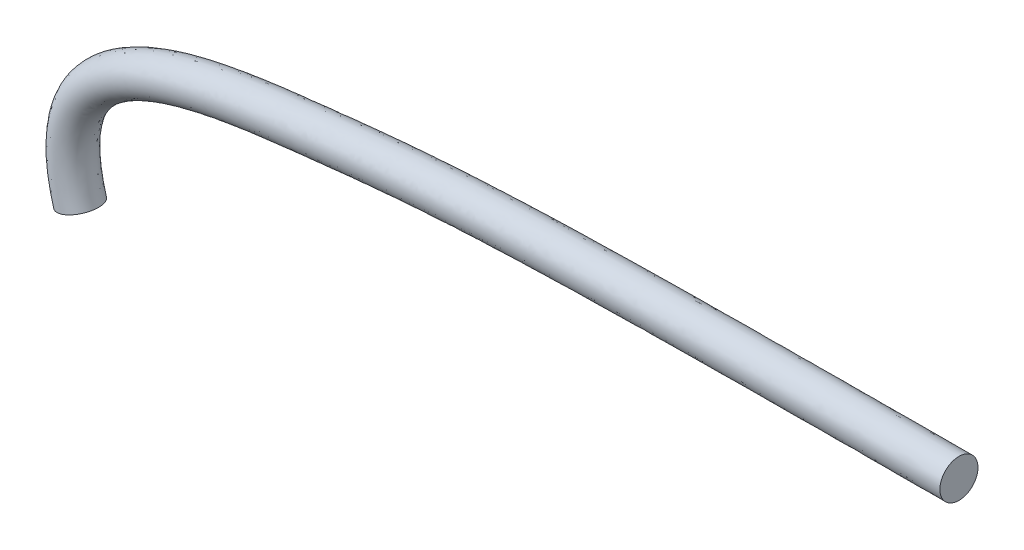
from build123d import *

# Parameters (mm, degrees)
SWEEP1_PROFILE_R = 15.85


with BuildPart() as part:
    # Sweep1: sweep along a path in Sketch2
    with BuildLine() as sweep1_path:  # in the path sketch's own coordinates; laid on its plane below (add() does not lay a ready-made edge on the line's plane)
        add(Edge.make_bspline(
            [(0, 0), (-35.877353721, 121.485322634), (260.065088602, 158.855298369), (368.820559408, 166.518453711), (730.653011233, 167.090760748)],
            knots=[0, 0, 0, 0, 0.439736349, 1, 1, 1, 1], degree=3))
    # Sweep1 profile (on start of the path) → Sweep1 (sweep)
    with BuildSketch(Plane(origin=(0, 0, 0), x_dir=(0.9590521032523852, 0.28322970050327745, 0), z_dir=(-0.28322970050327745, 0.9590521032523852, 0))):
        Circle(SWEEP1_PROFILE_R)
    sweep(path=Plane.XY * sweep1_path.line)


solid = part.part
